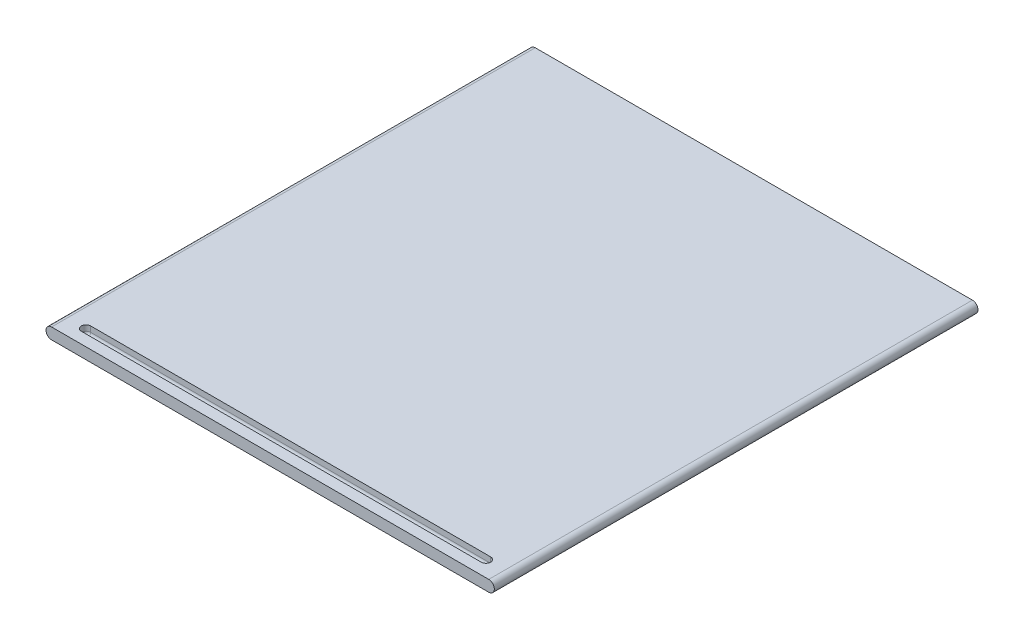
from build123d import *

# Parameters (mm, degrees)
AUFSATZ_LINEAR_AUSTRAGEN1_DEPTH = 52
SCHNITT_LINEAR_AUSTRAGEN1_DEPTH = 1
VERRUNDUNG2_R                   = 0.4


with BuildPart() as part:
    # Skizze1 → Aufsatz-Linear austragen1 (new body)
    with BuildSketch(Plane.XY):
        with BuildLine():
            Line((-23.5, 0.6), (23.5, 0.6))
            ThreePointArc((23.5, 0.6), (24.1, 0), (23.5, -0.6))
            Line((23.5, -0.6), (-23.5, -0.6))
            ThreePointArc((-23.5, -0.6), (-24.1, 0), (-23.5, 0.6))
        make_face()
    extrude(amount=AUFSATZ_LINEAR_AUSTRAGEN1_DEPTH)

    # Skizze2 → Schnitt-Linear austragen1 (cut)
    with BuildSketch(Plane(origin=(0, 0.6, 0), x_dir=(1, 0, 0), z_dir=(0, 1, 0))):
        with BuildLine():
            Line((-21.5, -49.8), (21.5, -49.8))
            ThreePointArc((21.5, -49.8), (22, -50.3), (21.5, -50.8))
            Line((21.5, -50.8), (-21.5, -50.8))
            ThreePointArc((-21.5, -50.8), (-22, -50.3), (-21.5, -49.8))
        make_face()
    extrude(amount=-SCHNITT_LINEAR_AUSTRAGEN1_DEPTH, mode=Mode.SUBTRACT)

    # Verrundung2
    verrundung2_edges = [part.edges().sort_by_distance(p)[0] for p in [
        (-22, -0.4, 50.3),
        (0, -0.4, 49.8),
        (22, -0.4, 50.3),
        (0, -0.4, 50.8),
    ]]
    fillet(verrundung2_edges, radius=VERRUNDUNG2_R)


solid = part.part
